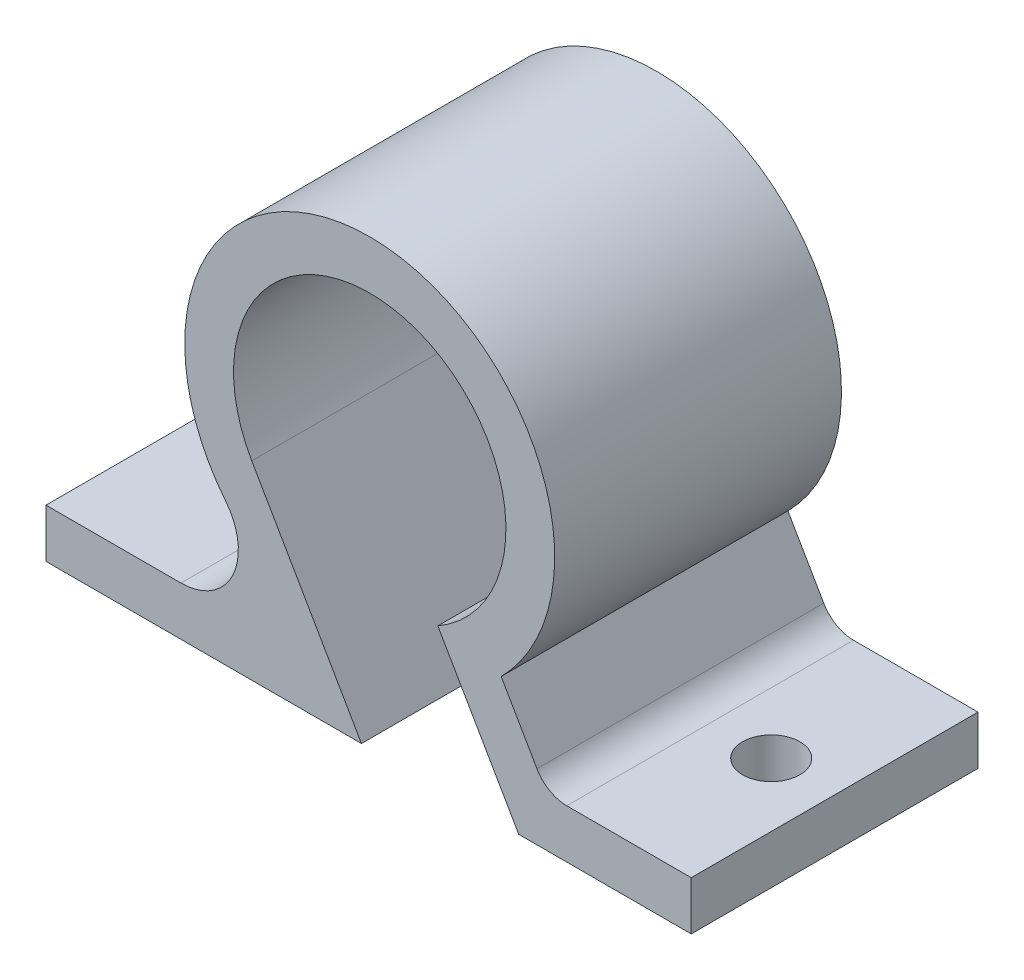
from build123d import *

# Parameters (mm, degrees)
BOSS_EXTRUDE1_DEPTH = 50
CUT_EXTRUDE1_REACH  = 199.772
SKETCH2_R           = 10


with BuildPart() as part:
    # Sketch1 → Boss-Extrude1 (new, symmetric)
    with BuildSketch(Plane.XY):
        with BuildLine():
            Line((-65.812232905, -73), (-112.886751346, -73))
            Line((-112.886751346, -73), (-112.886751346, -90))
            Line((-112.886751346, -90), (-2.886751346, -90))
            Line((-2.886751346, -90), (-41.13620668, -23.75))
            ThreePointArc((-41.13620668, -23.75), (12.293904642, 45.881476749), (23.75, -41.13620668))
            Line((23.75, -41.13620668), (51.961524227, -90))
            Line((51.961524227, -90), (112.113248654, -90))
            Line((112.113248654, -90), (112.113248654, -73))
            Line((112.113248654, -73), (68.704682034, -73))
            ThreePointArc((68.704682034, -73), (62.704682034, -71.392304845), (58.312377188, -67))
            Line((58.312377188, -67), (45.832116851, -45.383555005))
            ThreePointArc((45.832116851, -45.383555005), (3.304284934, 64.415306419), (-50.235373046, -40.455621302))
            ThreePointArc((-50.235373046, -40.455621302), (-47.772172291, -61.634593969), (-65.812232905, -73))
        make_face()
    extrude(amount=BOSS_EXTRUDE1_DEPTH, both=True)

    # Sketch2 → Cut-Extrude1 (cut, up to next)
    with BuildSketch(Plane.XZ.offset(90), mode=Mode.PRIVATE) as cut_extrude1_sk1:
        with Locations(Location((90, 0, 0), (0, 0, 270))):
            Circle(SKETCH2_R)
    cut_extrude1_tool1 = extrude(cut_extrude1_sk1.sketch, amount=-CUT_EXTRUDE1_REACH, mode=Mode.PRIVATE) & part.part
    # Sketch2 → Cut-Extrude1 (cut, up to next)
    with BuildSketch(Plane.XZ.offset(90), mode=Mode.PRIVATE) as cut_extrude1_sk2:
        with Locations(Location((-90, 0, 0), (0, 0, 270))):
            Circle(SKETCH2_R)
    cut_extrude1_tool2 = extrude(cut_extrude1_sk2.sketch, amount=-CUT_EXTRUDE1_REACH, mode=Mode.PRIVATE) & part.part
    add(cut_extrude1_tool1.solids().sort_by_distance((90, -90, 0))[0], mode=Mode.SUBTRACT)
    add(cut_extrude1_tool2.solids().sort_by_distance((-90, -90, 0))[0], mode=Mode.SUBTRACT)


solid = part.part
